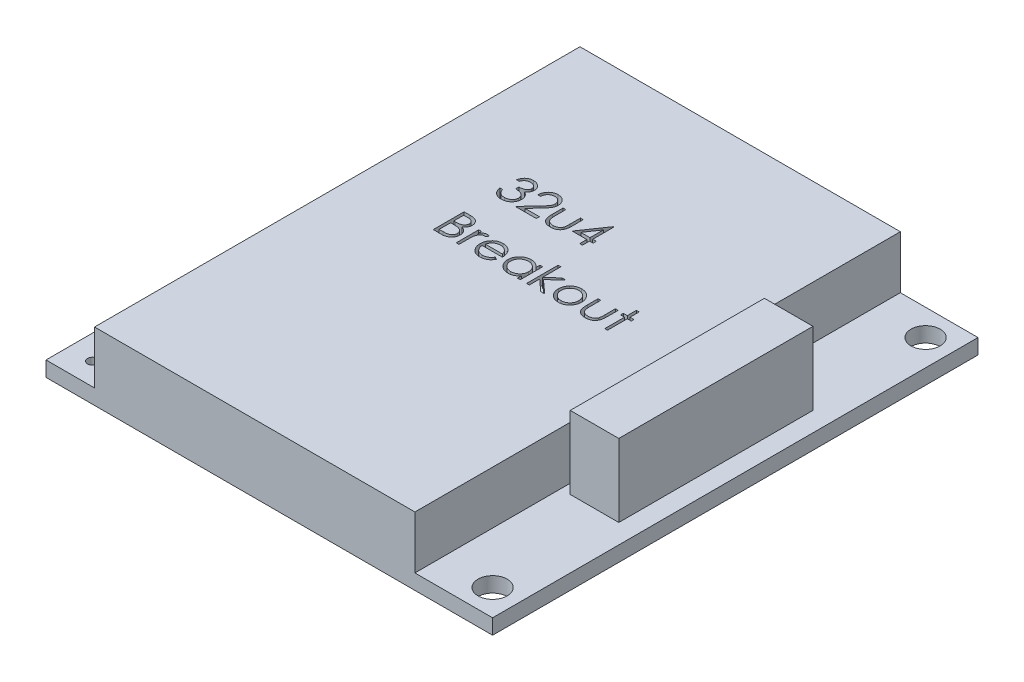
from build123d import *

# Parameters (mm, degrees)
SKETCH1_W             = 46
SKETCH1_H             = 50
BOSS_EXTRUDE1_DEPTH   = 7
F_3_0MM_DOWEL_HOLE1_D = 3
F_1_0MM_DOWEL_HOLE1_D = 1
LPATTERN1_COUNT       = 19
LPATTERN1_PITCH       = 2.54
SKETCH7_W             = 5
SKETCH7_H             = 50
SKETCH7_W_2           = 8
CUT_EXTRUDE1_DEPTH    = 5.44
CUT_EXTRUDE2_DEPTH    = 1
SKETCH9_W             = 5
SKETCH9_H             = 20
BOSS_EXTRUDE2_DEPTH   = 7.5


with BuildPart() as part:
    # Sketch1 → Boss-Extrude1 (new body)
    with BuildSketch(Plane(origin=(0, 0, 0), x_dir=(1, 0, 0), z_dir=(0, 1, 0))):
        Rectangle(SKETCH1_W, SKETCH1_H)
    extrude(amount=BOSS_EXTRUDE1_DEPTH)

    # Ø3.0mm Dowel Hole1 (through all)
    with Locations(Plane(origin=(0, 7, 0), x_dir=(1, 0, 0), z_dir=(0, 1, 0))):
        with Locations((20.3, 22.3), (20.3, -22.3)):
            Hole(F_3_0MM_DOWEL_HOLE1_D / 2)

    # Ø1.0mm Dowel Hole1 (through all)
    with Locations(Plane(origin=(0, 7, 0), x_dir=(1, 0, 0), z_dir=(0, 1, 0))):
        with Locations((-20.5, 23)):
            f_1_0mm_dowel_hole1 = Hole(F_1_0MM_DOWEL_HOLE1_D / 2)

    # LPattern1: Ø1.0mm Dowel Hole1 ×19
    with Locations(*[(0, 0, i * LPATTERN1_PITCH) for i in range(1, LPATTERN1_COUNT)]):
        add(f_1_0mm_dowel_hole1, mode=Mode.SUBTRACT)

    # Sketch7 → Cut-Extrude1 (cut)
    with BuildSketch(Plane(origin=(0, 7, 0), x_dir=(1, 0, 0), z_dir=(0, 1, 0))):
        with Locations((-20.5, 0)):
            Rectangle(SKETCH7_W, SKETCH7_H)
        with Locations((19, 0)):
            Rectangle(SKETCH7_W_2, SKETCH7_H)
    extrude(amount=-CUT_EXTRUDE1_DEPTH, mode=Mode.SUBTRACT)

    # Sketch8 → Cut-Extrude2 (cut)
    # profile 1 of 12: a face of its own
    with BuildSketch(Plane(origin=(0, 7, 0), x_dir=(1, 0, 0), z_dir=(0, 1, 0))):
        with BuildLine():
            Line((-9.122123343, 9.866687663), (-9.40705924, 9.866687663))
            add(Edge.make_bspline(
                [(-9.40705924, 9.866687663), (-9.399339862, 9.898648559), (-9.384249109, 9.961129497), (-9.352773454, 10.050398941), (-9.318484129, 10.134875278), (-9.277309727, 10.212976716), (-9.232398214, 10.286272864), (-9.180942603, 10.353101284), (-9.125316854, 10.415161617), (-9.063789936, 10.470237196), (-8.999266079, 10.520109851), (-8.930836102, 10.562632224), (-8.859876763, 10.599211991), (-8.785896421, 10.629347488), (-8.708674822, 10.652049213), (-8.628910093, 10.668520029), (-8.546393203, 10.679216254), (-8.490379318, 10.680260161), (-8.461937045, 10.680790227)],
                knots=[0, 0, 0, 0, 1.162005537, 2.271625781, 3.343758855, 4.383309926, 5.390229558, 6.379919256, 7.361854164, 8.333198761, 9.295911338, 10.242430842, 11.177959212, 12.116337295, 13.062827104, 14.020064771, 14.994644689, 16, 16, 16, 16], degree=3))
            add(Edge.make_bspline(
                [(-8.461937045, 10.680790227), (-8.420496272, 10.679539068), (-8.338518669, 10.677064042), (-8.218083619, 10.654463089), (-8.101945005, 10.618698861), (-7.991374044, 10.569283409), (-7.888668752, 10.508334918), (-7.79728664, 10.435795478), (-7.718466348, 10.353064683), (-7.652340734, 10.261685857), (-7.600565556, 10.16402693), (-7.562387203, 10.063515359), (-7.539144678, 9.960389571), (-7.536132459, 9.890759753), (-7.534623343, 9.855875363)],
                knots=[0, 0, 0, 0, 1.083050992, 2.142477498, 3.193116406, 4.255571735, 5.30263384, 6.308962982, 7.297363603, 8.282367274, 9.249857812, 10.179914175, 11.08814088, 12, 12, 12, 12], degree=3))
            add(Edge.make_bspline(
                [(-7.534623343, 9.855875363), (-7.535678886, 9.822304914), (-7.537744421, 9.756612754), (-7.555282854, 9.660708253), (-7.584797892, 9.570319087), (-7.625682605, 9.485064747), (-7.678606726, 9.405485785), (-7.742716958, 9.331403155), (-7.818465801, 9.262488276), (-7.875868838, 9.223009897), (-7.90542162, 9.202685259)],
                knots=[0, 0, 0, 0, 1.024540389, 2.004866551, 2.965041327, 3.920577974, 4.882998113, 5.874504559, 6.905732034, 8, 8, 8, 8], degree=3))
            add(Edge.make_bspline(
                [(-7.90542162, 9.202685259), (-7.8716471, 9.186376489), (-7.804730007, 9.154064099), (-7.713516312, 9.090694948), (-7.63071424, 9.017528118), (-7.584537295, 8.96043014), (-7.561336083, 8.931741749)],
                knots=[0, 0, 0, 0, 1.015518401, 2.012035669, 3.001164323, 4, 4, 4, 4], degree=3))
            add(Edge.make_bspline(
                [(-7.561336083, 8.931741749), (-7.54605858, 8.910825075), (-7.515753753, 8.86933425), (-7.478347233, 8.802626207), (-7.444411822, 8.735178784), (-7.417968409, 8.66518418), (-7.397490687, 8.593453661), (-7.382853, 8.519864059), (-7.373759673, 8.444355281), (-7.372457422, 8.393271817), (-7.37180283, 8.367594113)],
                knots=[0, 0, 0, 0, 1.025084078, 2.033381695, 3.024893161, 4.013698104, 4.991890475, 5.976764909, 6.982997093, 8, 8, 8, 8], degree=3))
            add(Edge.make_bspline(
                [(-7.37180283, 8.367594113), (-7.37343071, 8.323135295), (-7.37667881, 8.234426882), (-7.405711077, 8.10336767), (-7.450717374, 7.975255964), (-7.51463188, 7.852723789), (-7.592525978, 7.738078729), (-7.685197264, 7.635502363), (-7.791592792, 7.547329343), (-7.910252202, 7.473660065), (-8.038809883, 7.414770235), (-8.176310599, 7.373896698), (-8.320773148, 7.347275684), (-8.419839767, 7.344421024), (-8.470205274, 7.342969714)],
                knots=[0, 0, 0, 0, 0.955779014, 1.907060117, 2.875433937, 3.871313158, 4.872415639, 5.851225146, 6.836215519, 7.83643374, 8.849228613, 9.86973379, 10.916971861, 12, 12, 12, 12], degree=3))
            add(Edge.make_bspline(
                [(-8.470205274, 7.342969714), (-8.504149925, 7.343757308), (-8.570941679, 7.345307029), (-8.669133995, 7.355901189), (-8.762861537, 7.37525055), (-8.852251029, 7.401288549), (-8.937381884, 7.434301058), (-9.017994322, 7.475411591), (-9.094584297, 7.523772739), (-9.16642906, 7.579955351), (-9.233520046, 7.642803424), (-9.294074303, 7.713432668), (-9.349101401, 7.790537456), (-9.397127937, 7.875013371), (-9.440341459, 7.965768712), (-9.475884184, 8.063965564), (-9.507167521, 8.16872607), (-9.521712164, 8.241730877), (-9.529174625, 8.279187663)],
                knots=[0, 0, 0, 0, 1.048658725, 2.063410685, 3.046034179, 4.001477787, 4.936774919, 5.862367409, 6.792675028, 7.730719943, 8.675894397, 9.627829632, 10.600096036, 11.597688215, 12.626045268, 13.701542398, 14.82072376, 16, 16, 16, 16], degree=3))
            Line((-9.529174625, 8.279187663), (-9.244238728, 8.279187663))
            add(Edge.make_bspline(
                [(-9.244238728, 8.279187663), (-9.236815313, 8.254741058), (-9.222376127, 8.207190288), (-9.197797729, 8.138755154), (-9.169795796, 8.07601892), (-9.139756161, 8.018521373), (-9.108207142, 7.965696265), (-9.072905745, 7.918940427), (-9.036466592, 7.876200208), (-9.008998893, 7.852120453), (-8.995555835, 7.840335499)],
                knots=[0, 0, 0, 0, 1.198163088, 2.33053128, 3.407730985, 4.417276592, 5.372219308, 6.28897303, 7.162600585, 8, 8, 8, 8], degree=3))
            add(Edge.make_bspline(
                [(-8.995555835, 7.840335499), (-8.977778941, 7.826630082), (-8.942280025, 7.799261553), (-8.88443313, 7.764335076), (-8.823595697, 7.73407186), (-8.758449528, 7.710954508), (-8.690400415, 7.691380487), (-8.618348448, 7.678571159), (-8.542929301, 7.669782603), (-8.49143283, 7.669007058), (-8.465117133, 7.66861074)],
                knots=[0, 0, 0, 0, 0.946170439, 1.889420265, 2.845303464, 3.807233317, 4.801018734, 5.828864929, 6.890507805, 8, 8, 8, 8], degree=3))
            add(Edge.make_bspline(
                [(-8.465117133, 7.66861074), (-8.435405027, 7.669169454), (-8.377305569, 7.670261971), (-8.292528661, 7.680309219), (-8.211876905, 7.694941809), (-8.136245751, 7.717541443), (-8.064644505, 7.745464073), (-7.998076865, 7.780523697), (-7.935668969, 7.821657838), (-7.878220151, 7.868411217), (-7.826562441, 7.919593574), (-7.78107874, 7.97312686), (-7.742412082, 8.028785362), (-7.711221265, 8.086877086), (-7.686591837, 8.147161472), (-7.669824934, 8.209807696), (-7.658166774, 8.274303073), (-7.657217347, 8.318144352), (-7.656738728, 8.340245355)],
                knots=[0, 0, 0, 0, 1.217147791, 2.380027433, 3.494444702, 4.572153297, 5.609568379, 6.639424714, 7.649109417, 8.668170816, 9.669597737, 10.625200337, 11.543417969, 12.441394052, 13.322311151, 14.205496177, 15.095365482, 16, 16, 16, 16], degree=3))
            add(Edge.make_bspline(
                [(-7.656738728, 8.340245355), (-7.65812693, 8.369828498), (-7.660896426, 8.428847583), (-7.682040638, 8.515677097), (-7.716819465, 8.599336907), (-7.7655081, 8.678399659), (-7.824776939, 8.751674941), (-7.894050819, 8.817054072), (-7.973904998, 8.87100194), (-8.047401593, 8.908275221), (-8.112502842, 8.933708854), (-8.16821537, 8.950649714), (-8.230587431, 8.964994959), (-8.298864762, 8.978341091), (-8.373561823, 8.989699743), (-8.454597291, 8.999171961), (-8.541987589, 9.006751177), (-8.602486004, 9.010135813), (-8.633661805, 9.011879971)],
                knots=[0, 0, 0, 0, 1.07054697, 2.135767047, 3.216561865, 4.33974944, 5.486079747, 6.621378074, 7.775625952, 8.963672916, 9.598146892, 10.304877434, 11.070270905, 11.915000392, 12.823868403, 13.805723172, 14.86925407, 16, 16, 16, 16], degree=3))
            Line((-8.633661805, 9.011879971), (-8.633661805, 9.337520996))
            add(Edge.make_bspline(
                [(-8.633661805, 9.337520996), (-8.594381461, 9.338187568), (-8.517440918, 9.339493219), (-8.405051085, 9.355284771), (-8.297578866, 9.377129341), (-8.197406036, 9.41058948), (-8.106103274, 9.449451749), (-8.026891921, 9.494674825), (-7.960881723, 9.544943919), (-7.908393465, 9.601034928), (-7.868906237, 9.66119215), (-7.840034785, 9.723890832), (-7.822980203, 9.789680516), (-7.820703577, 9.834579251), (-7.81955924, 9.857147398)],
                knots=[0, 0, 0, 0, 1.321986639, 2.589447074, 3.816329219, 5.01088745, 6.139805852, 7.153945165, 8.075214402, 8.924034688, 9.728124013, 10.488707548, 11.240355623, 12, 12, 12, 12], degree=3))
            add(Edge.make_bspline(
                [(-7.81955924, 9.857147398), (-7.81993517, 9.873727924), (-7.820683065, 9.906714094), (-7.830114881, 9.954906121), (-7.844288119, 10.001624836), (-7.863773302, 10.046671564), (-7.889853839, 10.089733884), (-7.921064984, 10.131178927), (-7.958228904, 10.170770069), (-8.00081513, 10.207672931), (-8.046545839, 10.242842167), (-8.096665278, 10.272699538), (-8.149662264, 10.29823113), (-8.205595473, 10.319285464), (-8.264646418, 10.335123533), (-8.326537652, 10.346495332), (-8.391387194, 10.353605204), (-8.435630122, 10.354628838), (-8.458120939, 10.355149201)],
                knots=[0, 0, 0, 0, 0.884392785, 1.759457502, 2.611959086, 3.489218968, 4.37281399, 5.2945488, 6.255912374, 7.266815255, 8.301784654, 9.332968512, 10.37626691, 11.440494194, 12.520033166, 13.637162961, 14.798855837, 16, 16, 16, 16], degree=3))
            add(Edge.make_bspline(
                [(-8.458120939, 10.355149201), (-8.494272095, 10.353887037), (-8.564883711, 10.351421737), (-8.666678671, 10.329829004), (-8.76131121, 10.295377456), (-8.833645572, 10.254253932), (-8.887060478, 10.213658895), (-8.925230272, 10.178205588), (-8.962713878, 10.138805812), (-8.997045314, 10.093032857), (-9.031765278, 10.043986555), (-9.063374273, 9.989173643), (-9.094089851, 9.930023943), (-9.112597878, 9.888208617), (-9.122123343, 9.866687663)],
                knots=[0, 0, 0, 0, 1.472543308, 2.876219568, 4.221790263, 5.565193594, 6.249813518, 6.953379497, 7.687249741, 8.463570142, 9.283606569, 10.136032583, 11.040678096, 12, 12, 12, 12], degree=3))
        make_face()
    # profile 2 of 12: a face of its own
    with BuildSketch(Plane(origin=(0, 7, 0), x_dir=(1, 0, 0), z_dir=(0, 1, 0))):
        with BuildLine():
            Line((-6.679815651, 9.622456894), (-6.964751548, 9.622456894))
            add(Edge.make_bspline(
                [(-6.964751548, 9.622456894), (-6.962894488, 9.660258342), (-6.959247271, 9.73449938), (-6.942167323, 9.842743209), (-6.917728099, 9.946207205), (-6.883173708, 10.044060627), (-6.840260156, 10.137168688), (-6.788797917, 10.22516156), (-6.727843496, 10.307703566), (-6.658713101, 10.384029517), (-6.583630121, 10.454049671), (-6.502616876, 10.514515498), (-6.41748603, 10.565603671), (-6.328495861, 10.608313084), (-6.23464235, 10.640371372), (-6.136777186, 10.664158145), (-6.034470398, 10.678469545), (-5.964765521, 10.680007865), (-5.929314849, 10.680790227)],
                knots=[0, 0, 0, 0, 1.10065271, 2.161652631, 3.183658789, 4.190468796, 5.17591951, 6.163126047, 7.15150782, 8.156236427, 9.156009102, 10.134482811, 11.092018607, 12.041330605, 13.001268258, 13.972401359, 14.968799086, 16, 16, 16, 16], degree=3))
            add(Edge.make_bspline(
                [(-5.929314849, 10.680790227), (-5.894500454, 10.679975199), (-5.82609141, 10.678373697), (-5.726249439, 10.664620478), (-5.631201465, 10.643079834), (-5.541133277, 10.612857992), (-5.45676349, 10.572232118), (-5.377458299, 10.523430065), (-5.302273564, 10.46698779), (-5.234594553, 10.400536116), (-5.172447938, 10.329595382), (-5.11883375, 10.253859926), (-5.07292038, 10.175637646), (-5.034650127, 10.094332063), (-5.006477773, 10.00917763), (-4.98508897, 9.921414096), (-4.972999102, 9.830133017), (-4.97114361, 9.768350642), (-4.970200266, 9.736940067)],
                knots=[0, 0, 0, 0, 1.111607364, 2.184268762, 3.212621178, 4.221274766, 5.211760367, 6.196651075, 7.1921475, 8.207485113, 9.220403448, 10.201281604, 11.166441695, 12.114753415, 13.065576456, 14.026450734, 14.996634279, 16, 16, 16, 16], degree=3))
            add(Edge.make_bspline(
                [(-4.970200266, 9.736940067), (-4.971736297, 9.692718817), (-4.974781405, 9.605052337), (-5.000829446, 9.476224569), (-5.041511639, 9.351407682), (-5.090494955, 9.250953129), (-5.139909244, 9.170005602), (-5.184438626, 9.103358992), (-5.236567418, 9.031599031), (-5.297054342, 8.954966018), (-5.364648161, 8.872859697), (-5.439961124, 8.785329668), (-5.523530283, 8.693280277), (-5.58218478, 8.630410196), (-5.612578071, 8.597832495)],
                knots=[0, 0, 0, 0, 1.184426356, 2.348067706, 3.509069118, 4.696110526, 5.333549288, 6.050745305, 6.844228056, 7.710549037, 8.667450064, 9.695053472, 10.805634456, 12, 12, 12, 12], degree=3))
            Line((-5.612578071, 8.597832495), (-6.406964088, 7.750020996))
            Line((-6.406964088, 7.750020996), (-4.929495138, 7.750020996))
            Line((-4.929495138, 7.750020996), (-4.929495138, 7.424379971))
            Line((-4.929495138, 7.424379971), (-7.086866933, 7.424379971))
            Line((-7.086866933, 7.424379971), (-5.855536805, 8.73839239))
            add(Edge.make_bspline(
                [(-5.855536805, 8.73839239), (-5.82555765, 8.769687283), (-5.76797383, 8.829798366), (-5.686528207, 8.917558052), (-5.613377124, 8.998973706), (-5.548047061, 9.073891504), (-5.491955238, 9.143407283), (-5.442178285, 9.205269622), (-5.402295213, 9.262196873), (-5.359010533, 9.328183001), (-5.31708785, 9.40874846), (-5.281063069, 9.507204021), (-5.259096743, 9.608556601), (-5.256461642, 9.677047734), (-5.255136164, 9.711499362)],
                knots=[0, 0, 0, 0, 1.329631726, 2.553950428, 3.673215718, 4.687767853, 5.603093632, 6.413772471, 7.123043292, 7.734684054, 8.834405432, 9.900288307, 10.943827018, 12, 12, 12, 12], degree=3))
            add(Edge.make_bspline(
                [(-5.255136164, 9.711499362), (-5.255712873, 9.733163202), (-5.256849455, 9.77585847), (-5.266880367, 9.838456551), (-5.282039183, 9.898840347), (-5.303760953, 9.957195594), (-5.332432781, 10.012935579), (-5.367333633, 10.06612815), (-5.407601762, 10.11755314), (-5.454184699, 10.165770774), (-5.505358006, 10.209931582), (-5.559418504, 10.249051288), (-5.616613956, 10.28174391), (-5.67670321, 10.308544083), (-5.739518743, 10.329567464), (-5.805182047, 10.34413489), (-5.873511691, 10.353281143), (-5.920169219, 10.354518642), (-5.943943255, 10.355149201)],
                knots=[0, 0, 0, 0, 0.991446411, 1.95395049, 2.89581595, 3.838931463, 4.798493298, 5.75982156, 6.748411868, 7.785213223, 8.824556874, 9.840280684, 10.836137867, 11.835679398, 12.848801643, 13.863922112, 14.911575587, 16, 16, 16, 16], degree=3))
            add(Edge.make_bspline(
                [(-5.943943255, 10.355149201), (-5.96877251, 10.354500565), (-6.017533068, 10.35322675), (-6.089123905, 10.344316191), (-6.157418861, 10.328943893), (-6.22258973, 10.307919338), (-6.284746783, 10.281196226), (-6.343587737, 10.247911572), (-6.398980501, 10.208193689), (-6.451029204, 10.163162612), (-6.498984385, 10.113027003), (-6.541118337, 10.057137965), (-6.577933835, 9.996515952), (-6.610055068, 9.931324539), (-6.636140587, 9.860972181), (-6.656073374, 9.78570862), (-6.671845728, 9.705860653), (-6.677114886, 9.650719897), (-6.679815651, 9.622456894)],
                knots=[0, 0, 0, 0, 1.031018746, 2.02475058, 2.990194455, 3.934040569, 4.864654155, 5.795059489, 6.735614925, 7.690564532, 8.649604399, 9.611025574, 10.590972636, 11.591080095, 12.624614302, 13.701020113, 14.821632451, 16, 16, 16, 16], degree=3))
        make_face()
    # profile 3 of 12: a face of its own
    with BuildSketch(Plane(origin=(0, 7, 0), x_dir=(1, 0, 0), z_dir=(0, 1, 0))):
        with BuildLine():
            Line((-4.481738728, 9.744572278), (-4.19680283, 9.744572278))
            Line((-4.19680283, 9.744572278), (-4.19680283, 8.668430451))
            add(Edge.make_bspline(
                [(-4.19680283, 8.668430451), (-4.196674102, 8.636841243), (-4.196427851, 8.576412568), (-4.194757855, 8.48945822), (-4.190829842, 8.410158773), (-4.185918729, 8.338468419), (-4.179603077, 8.274399285), (-4.172088886, 8.218175154), (-4.163690175, 8.16915843), (-4.155468999, 8.139636957), (-4.151645579, 8.125907414)],
                knots=[0, 0, 0, 0, 1.388932606, 2.656963016, 3.823490214, 4.879454478, 5.816252168, 6.653371382, 7.373723809, 8, 8, 8, 8], degree=3))
            add(Edge.make_bspline(
                [(-4.151645579, 8.125907414), (-4.145511973, 8.108650953), (-4.133372278, 8.074496787), (-4.11135276, 8.02515819), (-4.084112769, 7.979460612), (-4.054304211, 7.935641918), (-4.019924034, 7.895000115), (-3.981407228, 7.857603837), (-3.940043113, 7.822040126), (-3.878579628, 7.779962493), (-3.794524437, 7.734863587), (-3.684168009, 7.695950951), (-3.564512032, 7.6726956), (-3.481812608, 7.669997526), (-3.439305835, 7.66861074)],
                knots=[0, 0, 0, 0, 0.725840625, 1.436591201, 2.137033971, 2.831655856, 3.53531722, 4.242432219, 4.957935707, 5.694543706, 7.190802206, 8.724350549, 10.316345118, 12, 12, 12, 12], degree=3))
            add(Edge.make_bspline(
                [(-3.439305835, 7.66861074), (-3.39680301, 7.670027015), (-3.314567908, 7.672767246), (-3.196226615, 7.695249456), (-3.088048546, 7.732810331), (-2.991119469, 7.785249912), (-2.905879028, 7.849423069), (-2.834845734, 7.924723917), (-2.776237724, 8.008770147), (-2.75064775, 8.071475742), (-2.737778391, 8.10301078)],
                knots=[0, 0, 0, 0, 1.157059328, 2.238695713, 3.266970494, 4.264342957, 5.228770407, 6.160125903, 7.074715775, 8, 8, 8, 8], degree=3))
            add(Edge.make_bspline(
                [(-2.737778391, 8.10301078), (-2.733973625, 8.115680208), (-2.725562217, 8.143689219), (-2.716524941, 8.191205134), (-2.708383822, 8.247869454), (-2.701432227, 8.314052971), (-2.696474544, 8.389582731), (-2.693802077, 8.474435129), (-2.690782856, 8.568343791), (-2.69073703, 8.634082402), (-2.690713087, 8.668430451)],
                knots=[0, 0, 0, 0, 0.557542046, 1.232589297, 2.036731608, 2.971723315, 4.038036528, 5.22795436, 6.551621927, 8, 8, 8, 8], degree=3))
            Line((-2.690713087, 8.668430451), (-2.690713087, 9.744572278))
            Line((-2.690713087, 9.744572278), (-2.405777189, 9.744572278))
            Line((-2.405777189, 9.744572278), (-2.405777189, 8.615004971))
            add(Edge.make_bspline(
                [(-2.405777189, 8.615004971), (-2.406177869, 8.576626322), (-2.406955244, 8.502166494), (-2.411951191, 8.393958765), (-2.42052334, 8.293118728), (-2.433534204, 8.199593007), (-2.44883378, 8.113453006), (-2.468569828, 8.034588323), (-2.492135801, 7.963241942), (-2.518720089, 7.898161901), (-2.550127069, 7.839155076), (-2.583534438, 7.783151871), (-2.622110481, 7.731541851), (-2.662723479, 7.681755912), (-2.707900696, 7.636270384), (-2.756795568, 7.594041545), (-2.808719898, 7.554423866), (-2.864825957, 7.518962491), (-2.924294671, 7.487015963), (-2.987199455, 7.458698521), (-3.05431079, 7.436289755), (-3.124762803, 7.416957936), (-3.198900667, 7.401795525), (-3.276652909, 7.391103425), (-3.35799334, 7.384549018), (-3.41342835, 7.383971127), (-3.441849906, 7.383674842)],
                knots=[0, 0, 0, 0, 1.493040784, 2.896703357, 4.213163133, 5.428574705, 6.569057535, 7.615249723, 8.588095153, 9.490268104, 10.346124644, 11.18633936, 12.024365274, 12.850166724, 13.684164916, 14.514361689, 15.362232829, 16.222528818, 17.093394965, 17.986930858, 18.902426812, 19.842810585, 20.827885679, 21.843828298, 22.894529745, 24, 24, 24, 24], degree=3))
            add(Edge.make_bspline(
                [(-3.441849906, 7.383674842), (-3.470058886, 7.383983005), (-3.525492159, 7.384588574), (-3.606836788, 7.391067214), (-3.684804452, 7.401778912), (-3.759117957, 7.417069002), (-3.829851874, 7.436154444), (-3.89729272, 7.458836222), (-3.96065081, 7.487030659), (-4.020687342, 7.518760301), (-4.076932365, 7.554651658), (-4.129645147, 7.593992665), (-4.178755006, 7.636724594), (-4.224272775, 7.682668982), (-4.265559546, 7.732395774), (-4.303129813, 7.785504961), (-4.337561967, 7.841470313), (-4.368724855, 7.901399039), (-4.395496233, 7.967232219), (-4.419132064, 8.040073157), (-4.438463857, 8.12072044), (-4.454195953, 8.209105118), (-4.466851903, 8.304804192), (-4.475638618, 8.408371254), (-4.48055155, 8.519554032), (-4.48133447, 8.596343575), (-4.481738728, 8.635993552)],
                knots=[0, 0, 0, 0, 1.083640291, 2.129454052, 3.13281866, 4.105697902, 5.042300162, 5.946461698, 6.836384745, 7.703652036, 8.553297018, 9.397182691, 10.228592656, 11.052265423, 11.879314572, 12.708807002, 13.549817954, 14.402308542, 15.300838682, 16.27712199, 17.341985831, 18.484375296, 19.725102775, 21.0496083, 22.476576903, 24, 24, 24, 24], degree=3))
            Line((-4.481738728, 8.635993552), (-4.481738728, 9.744572278))
        make_face()
    # profile 4 of 12: a face of its own
    with BuildSketch(Plane(origin=(0, 7, 0), x_dir=(1, 0, 0), z_dir=(0, 1, 0))):
        Polygon((-0.224872742, 10.680790227), (-0.166995138, 10.680790227), (-0.166995138, 8.482713304), (0.199351016, 8.482713304), (0.199351016, 8.157072278), (-0.166995138, 8.157072278), (-0.166995138, 7.424379971), (-0.451931035, 7.424379971), (-0.451931035, 8.157072278), (-1.958020779, 8.157072278), align=None)
        Polygon((-0.451931035, 8.482713304), (-0.451931035, 9.861599522), (-1.398325266, 8.482713304), align=None, mode=Mode.SUBTRACT)
    # profile 5 of 12: a face of its own
    with BuildSketch(Plane(origin=(0, 7, 0), x_dir=(1, 0, 0), z_dir=(0, 1, 0))):
        with BuildLine():
            Line((-9.244238728, 4.307713304), (-8.624757558, 4.307713304))
            add(Edge.make_bspline(
                [(-8.624757558, 4.307713304), (-8.594433153, 4.307553873), (-8.535656908, 4.307244857), (-8.450186414, 4.302452302), (-8.370132136, 4.295917544), (-8.295470857, 4.285548817), (-8.226237077, 4.273037705), (-8.162222149, 4.257886772), (-8.103629636, 4.239719773), (-8.033677368, 4.210830646), (-7.953920768, 4.167901772), (-7.867562226, 4.104466574), (-7.793716952, 4.026876411), (-7.730047935, 3.939352859), (-7.679428348, 3.843072552), (-7.642807629, 3.740330288), (-7.619622985, 3.632451279), (-7.617238619, 3.558389253), (-7.616033599, 3.520959498)],
                knots=[0, 0, 0, 0, 1.001505555, 1.941167018, 2.826882275, 3.653841531, 4.429895133, 5.150066043, 5.825578002, 6.45369114, 7.647487171, 8.808567382, 9.977351308, 11.170798116, 12.373658725, 13.556498008, 14.765093433, 16, 16, 16, 16], degree=3))
            add(Edge.make_bspline(
                [(-7.616033599, 3.520959498), (-7.617025305, 3.485896108), (-7.618974099, 3.41699324), (-7.637609317, 3.316215013), (-7.666783637, 3.22028355), (-7.707337685, 3.129548957), (-7.760044495, 3.046061323), (-7.822508827, 2.96914716), (-7.897871355, 2.902062987), (-7.954334866, 2.864559068), (-7.983015771, 2.845508777)],
                knots=[0, 0, 0, 0, 1.044552857, 2.05264487, 3.044412934, 4.028983338, 5.005914585, 5.980388656, 6.974128949, 8, 8, 8, 8], degree=3))
            add(Edge.make_bspline(
                [(-7.983015771, 2.845508777), (-7.946947383, 2.831661242), (-7.877939622, 2.805167478), (-7.782974454, 2.758326735), (-7.701154844, 2.707379678), (-7.631851719, 2.651742928), (-7.572581132, 2.591772793), (-7.520825964, 2.526589939), (-7.476665003, 2.455344066), (-7.438825422, 2.378778002), (-7.409299051, 2.297673562), (-7.387186623, 2.212791501), (-7.374516151, 2.124436191), (-7.372713077, 2.064305882), (-7.37180283, 2.033950283)],
                knots=[0, 0, 0, 0, 1.27268992, 2.434971085, 3.483601985, 4.442670788, 5.356604649, 6.2567628, 7.179492994, 8.113709626, 9.066344395, 10.018646069, 10.999752585, 12, 12, 12, 12], degree=3))
            add(Edge.make_bspline(
                [(-7.37180283, 2.033950283), (-7.372688969, 2.002956049), (-7.374432472, 1.941974025), (-7.387295732, 1.85238901), (-7.409075422, 1.766777452), (-7.439075676, 1.684585607), (-7.478230062, 1.605972485), (-7.525880429, 1.530849024), (-7.582696205, 1.459970025), (-7.646253236, 1.392547881), (-7.718155325, 1.331925531), (-7.795730332, 1.277936283), (-7.879955207, 1.233535212), (-7.969446659, 1.196237107), (-8.065208574, 1.167746291), (-8.16681094, 1.147814028), (-8.274166128, 1.134383744), (-8.347834973, 1.133279565), (-8.38561493, 1.132713304)],
                knots=[0, 0, 0, 0, 0.978564426, 1.925352924, 2.850884081, 3.763762016, 4.682927383, 5.618979971, 6.567305752, 7.547517671, 8.540179244, 9.531824382, 10.526200242, 11.540722885, 12.589160233, 13.674978461, 14.80764778, 16, 16, 16, 16], degree=3))
            Line((-8.38561493, 1.132713304), (-9.244238728, 1.132713304))
            Line((-9.244238728, 1.132713304), (-9.244238728, 4.307713304))
        make_face()
        with BuildLine():
            Line((-8.95930283, 3.982072278), (-8.95930283, 2.964444073))
            Line((-8.95930283, 2.964444073), (-8.767861524, 2.964444073))
            add(Edge.make_bspline(
                [(-8.767861524, 2.964444073), (-8.73987726, 2.96480686), (-8.685805958, 2.965507839), (-8.607501481, 2.967515816), (-8.534816643, 2.973138326), (-8.467876908, 2.978759221), (-8.406787691, 2.987898311), (-8.351684331, 2.99877688), (-8.301702033, 3.010282087), (-8.244062588, 3.029848693), (-8.178682127, 3.058766298), (-8.108983526, 3.103644321), (-8.047538685, 3.157097127), (-7.995652665, 3.218774642), (-7.953187974, 3.286688968), (-7.92369339, 3.359756495), (-7.903693353, 3.436156187), (-7.90188675, 3.488605602), (-7.900969497, 3.515235339)],
                knots=[0, 0, 0, 0, 1.156816544, 2.235205308, 3.236616184, 4.169592532, 5.011045266, 5.787822928, 6.49130361, 7.128639758, 8.301311294, 9.436451833, 10.541879658, 11.654887649, 12.756523258, 13.837046038, 14.901820046, 16, 16, 16, 16], degree=3))
            add(Edge.make_bspline(
                [(-7.900969497, 3.515235339), (-7.901446817, 3.532857289), (-7.902383134, 3.567424668), (-7.910051487, 3.617815868), (-7.92308493, 3.665208415), (-7.93982561, 3.710251786), (-7.963219635, 3.751537536), (-7.990763633, 3.790493149), (-8.024042795, 3.825792), (-8.061922643, 3.85878433), (-8.105473323, 3.888034723), (-8.154668852, 3.91365313), (-8.210174816, 3.934282263), (-8.271055763, 3.952349059), (-8.338248821, 3.965038439), (-8.410978594, 3.975609727), (-8.489840804, 3.980991571), (-8.544401004, 3.981704008), (-8.572604112, 3.982072278)],
                knots=[0, 0, 0, 0, 0.91205012, 1.789085906, 2.630437955, 3.453916878, 4.269457761, 5.079663411, 5.91843418, 6.774407191, 7.675494373, 8.627863946, 9.638891023, 10.736472738, 11.911756761, 13.175263542, 14.539845004, 16, 16, 16, 16], degree=3))
            Line((-8.572604112, 3.982072278), (-8.95930283, 3.982072278))
        make_face(mode=Mode.SUBTRACT)
        with BuildLine():
            Line((-8.95930283, 2.638803047), (-8.95930283, 1.45835433))
            Line((-8.95930283, 1.45835433), (-8.553523583, 1.45835433))
            add(Edge.make_bspline(
                [(-8.553523583, 1.45835433), (-8.524477843, 1.458702443), (-8.468496009, 1.459373386), (-8.387668464, 1.461563732), (-8.312753792, 1.466546011), (-8.24409384, 1.474389032), (-8.180947215, 1.482896625), (-8.124071442, 1.494336858), (-8.073005473, 1.50744413), (-8.013792351, 1.527704415), (-7.947114169, 1.55917907), (-7.875258606, 1.606635547), (-7.811371965, 1.663171691), (-7.757120052, 1.728604734), (-7.712658269, 1.799753152), (-7.680313678, 1.875177863), (-7.660364829, 1.953632591), (-7.657949861, 2.007123823), (-7.656738728, 2.033950283)],
                knots=[0, 0, 0, 0, 1.160039823, 2.235823828, 3.228722157, 4.157150951, 4.99529583, 5.772374946, 6.472645482, 7.099169577, 8.269452708, 9.405989375, 10.527446681, 11.663510218, 12.788923519, 13.866172445, 14.929861265, 16, 16, 16, 16], degree=3))
            add(Edge.make_bspline(
                [(-7.656738728, 2.033950283), (-7.656989194, 2.050726385), (-7.657486086, 2.084007988), (-7.664979644, 2.132917339), (-7.67587794, 2.180293666), (-7.689967169, 2.226265617), (-7.710486257, 2.270002037), (-7.734440766, 2.31236793), (-7.76252718, 2.353419301), (-7.806291531, 2.405318988), (-7.869947545, 2.465115135), (-7.960395834, 2.523659869), (-8.063240705, 2.570874666), (-8.137832787, 2.590922048), (-8.17636513, 2.601278007)],
                knots=[0, 0, 0, 0, 0.723448775, 1.435228256, 2.130040452, 2.821711965, 3.505591119, 4.210454504, 4.921174351, 5.648778258, 7.137944449, 8.670945889, 10.280296675, 12, 12, 12, 12], degree=3))
            add(Edge.make_bspline(
                [(-8.17636513, 2.601278007), (-8.191812953, 2.604412262), (-8.225307018, 2.611207973), (-8.279923895, 2.61838139), (-8.342277147, 2.624772265), (-8.412510758, 2.62949953), (-8.490713585, 2.634385894), (-8.577052647, 2.636286196), (-8.671175354, 2.638553382), (-8.73648272, 2.638717697), (-8.770405595, 2.638803047)],
                knots=[0, 0, 0, 0, 0.634451884, 1.375622551, 2.216452059, 3.157844607, 4.20941857, 5.370758133, 6.634282058, 8, 8, 8, 8], degree=3))
            Line((-8.770405595, 2.638803047), (-8.95930283, 2.638803047))
        make_face(mode=Mode.SUBTRACT)
    # profile 6 of 12: a face of its own
    with BuildSketch(Plane(origin=(0, 7, 0), x_dir=(1, 0, 0), z_dir=(0, 1, 0))):
        with BuildLine():
            Line((-6.883341292, 3.452905612), (-6.598405394, 3.452905612))
            Line((-6.598405394, 3.452905612), (-6.598405394, 3.111364145))
            add(Edge.make_bspline(
                [(-6.598405394, 3.111364145), (-6.577369877, 3.143164789), (-6.537139615, 3.203983275), (-6.470271458, 3.284418998), (-6.40177915, 3.351016933), (-6.331334801, 3.404087982), (-6.258420382, 3.44383274), (-6.184636147, 3.472945707), (-6.108821257, 3.490160843), (-6.057874368, 3.492459234), (-6.032349705, 3.49361074)],
                knots=[0, 0, 0, 0, 1.2804753, 2.448899062, 3.506932113, 4.484331642, 5.4025378, 6.288909075, 7.142734305, 8, 8, 8, 8], degree=3))
            add(Edge.make_bspline(
                [(-6.032349705, 3.49361074), (-6.012550109, 3.492530762), (-5.971811153, 3.490308638), (-5.910141232, 3.474695961), (-5.846601815, 3.449769469), (-5.805651221, 3.426328696), (-5.78430283, 3.414108536)],
                knots=[0, 0, 0, 0, 0.901110191, 1.854092781, 2.881294221, 4, 4, 4, 4], degree=3))
            Line((-5.78430283, 3.414108536), (-5.940763167, 3.167333696))
            add(Edge.make_bspline(
                [(-5.940763167, 3.167333696), (-5.954469207, 3.173448081), (-5.980485896, 3.185054353), (-6.018544681, 3.198790319), (-6.05363418, 3.206878328), (-6.075989408, 3.208103622), (-6.086411204, 3.208674842)],
                knots=[0, 0, 0, 0, 1.180555205, 2.24091978, 3.179933427, 4, 4, 4, 4], degree=3))
            add(Edge.make_bspline(
                [(-6.086411204, 3.208674842), (-6.109276405, 3.207150808), (-6.155914787, 3.204042221), (-6.224390011, 3.179604874), (-6.290835691, 3.140121263), (-6.343605699, 3.096332469), (-6.384465457, 3.054106967), (-6.413621233, 3.017233059), (-6.440366296, 2.975886729), (-6.46592071, 2.930774801), (-6.489203706, 2.881127013), (-6.510934013, 2.827439383), (-6.530581696, 2.769649731), (-6.541785131, 2.729388445), (-6.547523984, 2.708764987)],
                knots=[0, 0, 0, 0, 1.125678352, 2.296057538, 3.5422874, 4.923748041, 5.663163013, 6.437101912, 7.23742474, 8.08941207, 8.991984279, 9.93940061, 10.944477711, 12, 12, 12, 12], degree=3))
            add(Edge.make_bspline(
                [(-6.547523984, 2.708764987), (-6.551816941, 2.690370693), (-6.561325514, 2.649628732), (-6.570570695, 2.581276856), (-6.579705186, 2.50051968), (-6.586142833, 2.407132413), (-6.592110057, 2.301348268), (-6.595475631, 2.183006088), (-6.598290623, 2.051984406), (-6.598365977, 1.960386242), (-6.598405394, 1.912470916)],
                knots=[0, 0, 0, 0, 0.566838948, 1.255505196, 2.06880316, 3.007127437, 4.065329342, 5.249902469, 6.561414163, 8, 8, 8, 8], degree=3))
            Line((-6.598405394, 1.912470916), (-6.598405394, 1.132713304))
            Line((-6.598405394, 1.132713304), (-6.883341292, 1.132713304))
            Line((-6.883341292, 1.132713304), (-6.883341292, 3.452905612))
        make_face()
    # profile 7 of 12: a face of its own
    with BuildSketch(Plane(origin=(0, 7, 0), x_dir=(1, 0, 0), z_dir=(0, 1, 0))):
        with BuildLine():
            Line((-3.595130154, 1.865405612), (-3.341995138, 1.732477927))
            add(Edge.make_bspline(
                [(-3.341995138, 1.732477927), (-3.362166906, 1.696697191), (-3.40141318, 1.627082048), (-3.468905287, 1.531440289), (-3.539655238, 1.445399861), (-3.616856695, 1.371259389), (-3.698199904, 1.306624204), (-3.784135955, 1.250074891), (-3.87511224, 1.201888805), (-3.971133061, 1.161291869), (-4.073004797, 1.130077542), (-4.180974316, 1.108030142), (-4.295248458, 1.094401891), (-4.373576778, 1.092818799), (-4.413684841, 1.092008176)],
                knots=[0, 0, 0, 0, 1.120438281, 2.179929193, 3.190490725, 4.156257408, 5.095198341, 6.022838206, 6.959905092, 7.901321166, 8.864066838, 9.862729781, 10.905609505, 12, 12, 12, 12], degree=3))
            add(Edge.make_bspline(
                [(-4.413684841, 1.092008176), (-4.458263635, 1.093048828), (-4.545223948, 1.095078838), (-4.671806433, 1.112579859), (-4.790986334, 1.141129785), (-4.90275695, 1.181012812), (-5.006844565, 1.233107598), (-5.103456055, 1.296570843), (-5.193099482, 1.371076531), (-5.272950014, 1.457270019), (-5.344835537, 1.54951008), (-5.408268245, 1.645627204), (-5.461297486, 1.745379558), (-5.504434496, 1.848132104), (-5.539273195, 1.953237208), (-5.563554419, 2.061651182), (-5.577551405, 2.173080605), (-5.579696295, 2.248461759), (-5.580777189, 2.286449281)],
                knots=[0, 0, 0, 0, 1.145258523, 2.234067595, 3.276747158, 4.290159414, 5.277019952, 6.260822364, 7.254936242, 8.264827045, 9.274100331, 10.257902744, 11.220704747, 12.172965371, 13.118907548, 14.062713208, 15.023725156, 16, 16, 16, 16], degree=3))
            add(Edge.make_bspline(
                [(-5.580777189, 2.286449281), (-5.579816397, 2.322095306), (-5.577912233, 2.39274102), (-5.565910019, 2.497303335), (-5.544639067, 2.598929146), (-5.515450545, 2.697702895), (-5.477757628, 2.793459202), (-5.431645544, 2.886256346), (-5.377042458, 2.97599558), (-5.334885104, 3.032604137), (-5.313649785, 3.061118753)],
                knots=[0, 0, 0, 0, 1.024358464, 2.0301432, 3.019427413, 4.004406732, 4.986367066, 5.972626655, 6.978780325, 8, 8, 8, 8], degree=3))
            add(Edge.make_bspline(
                [(-5.313649785, 3.061118753), (-5.284886387, 3.095471228), (-5.228270743, 3.163087978), (-5.132516049, 3.251932031), (-5.028829442, 3.326357456), (-4.918510325, 3.388049643), (-4.800276523, 3.434925023), (-4.67571738, 3.469856901), (-4.543414599, 3.48943124), (-4.45296772, 3.49219606), (-4.406688647, 3.49361074)],
                knots=[0, 0, 0, 0, 1.030682036, 2.02871468, 2.997146059, 3.962720338, 4.930598197, 5.918074684, 6.934738563, 8, 8, 8, 8], degree=3))
            add(Edge.make_bspline(
                [(-4.406688647, 3.49361074), (-4.359111177, 3.492382424), (-4.265775025, 3.489972748), (-4.129674458, 3.467633146), (-4.000895808, 3.4322069), (-3.879490608, 3.382174533), (-3.765446549, 3.317622654), (-3.659504918, 3.237665412), (-3.559853903, 3.144757576), (-3.501879692, 3.073308093), (-3.472378752, 3.036950083)],
                knots=[0, 0, 0, 0, 1.056321875, 2.072262726, 3.055038591, 4.01806755, 4.982017516, 5.957941055, 6.960871419, 8, 8, 8, 8], degree=3))
            add(Edge.make_bspline(
                [(-3.472378752, 3.036950083), (-3.452306458, 3.00955112), (-3.412295477, 2.954935569), (-3.362178465, 2.865880305), (-3.318674256, 2.772707123), (-3.283900784, 2.673909925), (-3.255743523, 2.570659306), (-3.23537198, 2.46221714), (-3.223425255, 2.348615721), (-3.221076936, 2.271212345), (-3.219879753, 2.231751765)],
                knots=[0, 0, 0, 0, 0.94817472, 1.890038105, 2.849395472, 3.817997239, 4.812318967, 5.836947057, 6.897266129, 8, 8, 8, 8], degree=3))
            Line((-3.219879753, 2.231751765), (-5.295841292, 2.231751765))
            add(Edge.make_bspline(
                [(-5.295841292, 2.231751765), (-5.294444649, 2.20118063), (-5.291698207, 2.141063725), (-5.278893755, 2.053097372), (-5.258710939, 1.969301554), (-5.230345432, 1.890304795), (-5.195994794, 1.815075322), (-5.153916322, 1.744171189), (-5.103715441, 1.677915352), (-5.047721414, 1.615715163), (-4.985394263, 1.56032433), (-4.919823485, 1.510747361), (-4.850070037, 1.469195141), (-4.776683919, 1.43546767), (-4.699783799, 1.409064083), (-4.619345451, 1.391041131), (-4.53552716, 1.378969685), (-4.478390101, 1.377627417), (-4.449301829, 1.376944073)],
                knots=[0, 0, 0, 0, 1.094153842, 2.151609401, 3.174256925, 4.172055639, 5.149267565, 6.128595816, 7.11444997, 8.118368179, 9.117203808, 10.09244225, 11.054858984, 12.015122123, 12.976791628, 13.957293641, 14.960065497, 16, 16, 16, 16], degree=3))
            add(Edge.make_bspline(
                [(-4.449301829, 1.376944073), (-4.420861859, 1.377495667), (-4.364431504, 1.378590136), (-4.280393012, 1.389232655), (-4.19771644, 1.406441405), (-4.116743977, 1.429927325), (-4.039118995, 1.458572041), (-3.967231961, 1.493136776), (-3.901119194, 1.531372618), (-3.839327374, 1.57510568), (-3.779391544, 1.628634535), (-3.719935146, 1.695432654), (-3.656184182, 1.774433482), (-3.616279337, 1.833892765), (-3.595130154, 1.865405612)],
                knots=[0, 0, 0, 0, 0.99110716, 1.966546729, 2.947904876, 3.932708344, 4.903319531, 5.828989031, 6.710028674, 7.56322171, 8.463672341, 9.504779593, 10.677557249, 12, 12, 12, 12], degree=3))
        make_face()
        with BuildLine():
            add(Edge.make_bspline(
                [(-3.504815651, 2.516687663), (-3.515244732, 2.554481841), (-3.535317355, 2.627223468), (-3.577260343, 2.727953419), (-3.624496669, 2.817477443), (-3.680396382, 2.895110396), (-3.743731941, 2.96405644), (-3.816888642, 3.024307585), (-3.898926917, 3.078207702), (-3.989422709, 3.123703183), (-4.0852549, 3.162428984), (-4.185590517, 3.188396053), (-4.287968653, 3.206184709), (-4.357214755, 3.20784125), (-4.392060242, 3.208674842)],
                knots=[0, 0, 0, 0, 1.154881502, 2.222775134, 3.210006277, 4.132804581, 5.035138423, 5.962687519, 6.919655026, 7.923214229, 8.944639381, 9.960483929, 10.97369054, 12, 12, 12, 12], degree=3))
            add(Edge.make_bspline(
                [(-4.392060242, 3.208674842), (-4.420498661, 3.208119969), (-4.476715437, 3.207023101), (-4.559538549, 3.196618055), (-4.639076562, 3.179418767), (-4.715916358, 3.155864842), (-4.789051003, 3.124469895), (-4.859984829, 3.087655111), (-4.926914188, 3.042713817), (-4.968770935, 3.008461142), (-4.989916813, 2.991156813)],
                knots=[0, 0, 0, 0, 1.04873581, 2.073130211, 3.073294108, 4.04793562, 5.032784715, 6.005352987, 6.992311501, 8, 8, 8, 8], degree=3))
            add(Edge.make_bspline(
                [(-4.989916813, 2.991156813), (-5.005060004, 2.977464113), (-5.035706133, 2.949753424), (-5.076655035, 2.902011215), (-5.115862178, 2.850529441), (-5.15154342, 2.793338507), (-5.184270945, 2.731089657), (-5.214896067, 2.664307945), (-5.242460884, 2.592486605), (-5.257969498, 2.542437321), (-5.265948463, 2.516687663)],
                knots=[0, 0, 0, 0, 0.879870761, 1.780643979, 2.707998968, 3.669668524, 4.684282772, 5.740141944, 6.837334558, 8, 8, 8, 8], degree=3))
            Line((-5.265948463, 2.516687663), (-3.504815651, 2.516687663))
        make_face(mode=Mode.SUBTRACT)
    # profile 8 of 12: a face of its own
    with BuildSketch(Plane(origin=(0, 7, 0), x_dir=(1, 0, 0), z_dir=(0, 1, 0))):
        with BuildLine():
            Line((-0.289110522, 3.452905612), (-0.289110522, 1.132713304))
            Line((-0.289110522, 1.132713304), (-0.57404642, 1.132713304))
            Line((-0.57404642, 1.132713304), (-0.57404642, 1.534040427))
            add(Edge.make_bspline(
                [(-0.57404642, 1.534040427), (-0.606176323, 1.497718796), (-0.668878232, 1.426836675), (-0.773599818, 1.334233561), (-0.884605237, 1.257690369), (-1.001355721, 1.19586866), (-1.123745841, 1.149430152), (-1.251504292, 1.116422708), (-1.384683188, 1.095201157), (-1.475626395, 1.093082052), (-1.521712686, 1.092008176)],
                knots=[0, 0, 0, 0, 1.074387032, 2.096679803, 3.090159297, 4.057316773, 5.018401886, 5.985159533, 6.978961417, 8, 8, 8, 8], degree=3))
            add(Edge.make_bspline(
                [(-1.521712686, 1.092008176), (-1.562686473, 1.093120671), (-1.643488594, 1.09531456), (-1.762350686, 1.112334649), (-1.876734369, 1.139667428), (-1.986747731, 1.17767752), (-2.091678892, 1.228097265), (-2.192426265, 1.288459683), (-2.288467922, 1.360342436), (-2.378339961, 1.442518719), (-2.461100418, 1.531777029), (-2.53372743, 1.626977632), (-2.594282009, 1.727708865), (-2.644918797, 1.832695369), (-2.683922623, 1.942745332), (-2.711112992, 2.057478191), (-2.728113254, 2.176758291), (-2.730306236, 2.25798343), (-2.731418215, 2.299169634)],
                knots=[0, 0, 0, 0, 1.033919861, 2.038935746, 3.024066025, 3.998881131, 4.97069526, 5.957263378, 6.95902576, 7.993208707, 9.027059324, 10.027763471, 11.009749337, 11.988697705, 12.965288445, 13.950418724, 14.960734635, 16, 16, 16, 16], degree=3))
            add(Edge.make_bspline(
                [(-2.731418215, 2.299169634), (-2.730281591, 2.339504565), (-2.728034546, 2.419244548), (-2.71129484, 2.536518795), (-2.683145282, 2.649474646), (-2.643641163, 2.757748445), (-2.592984532, 2.861471204), (-2.531364053, 2.960716284), (-2.458775276, 3.055757095), (-2.375089164, 3.144358851), (-2.284434051, 3.226201836), (-2.187452559, 3.297330042), (-2.086557154, 3.358758898), (-1.980182852, 3.407430265), (-1.869904121, 3.446808525), (-1.75473921, 3.474052717), (-1.635167277, 3.490106716), (-1.553986617, 3.492431509), (-1.512808439, 3.49361074)],
                knots=[0, 0, 0, 0, 1.020392517, 2.01726096, 2.990465484, 3.961182959, 4.928053699, 5.906110375, 6.912531644, 7.948652711, 8.985773172, 9.998621852, 10.987621588, 11.969261332, 12.953316658, 13.946091881, 14.958173133, 16, 16, 16, 16], degree=3))
            add(Edge.make_bspline(
                [(-1.512808439, 3.49361074), (-1.46545571, 3.492306494), (-1.372599243, 3.489748929), (-1.236774548, 3.468464883), (-1.108282772, 3.432507131), (-0.986132038, 3.383596258), (-0.870760988, 3.318600625), (-0.763261852, 3.236613089), (-0.662509592, 3.138150726), (-0.60410747, 3.062521823), (-0.57404642, 3.023593713)],
                knots=[0, 0, 0, 0, 1.038897134, 2.037228247, 3.008116434, 3.962042015, 4.918381754, 5.904844433, 6.921570401, 8, 8, 8, 8], degree=3))
            Line((-0.57404642, 3.023593713), (-0.57404642, 3.452905612))
            Line((-0.57404642, 3.452905612), (-0.289110522, 3.452905612))
        make_face()
        with BuildLine():
            add(Edge.make_bspline(
                [(-1.508992333, 3.208674842), (-1.550643197, 3.2071929), (-1.632855377, 3.20426778), (-1.753545293, 3.181431824), (-1.869036747, 3.143436513), (-1.978752115, 3.091473646), (-2.080958283, 3.026133292), (-2.172301827, 2.947101751), (-2.253529849, 2.856535317), (-2.321845203, 2.754842688), (-2.377535154, 2.645823991), (-2.416693818, 2.53186468), (-2.442519493, 2.415020164), (-2.445157936, 2.335769728), (-2.446482317, 2.295989546)],
                knots=[0, 0, 0, 0, 1.031046209, 2.035121221, 3.029706178, 4.034933723, 5.034054252, 6.02443088, 7.017295772, 8.038157696, 9.050218397, 10.03989886, 11.016116709, 12, 12, 12, 12], degree=3))
            add(Edge.make_bspline(
                [(-2.446482317, 2.295989546), (-2.444790593, 2.256447091), (-2.441413774, 2.177517176), (-2.417147073, 2.060513367), (-2.376434616, 1.9465272), (-2.320879317, 1.836526156), (-2.251313593, 1.734396294), (-2.170678887, 1.642103468), (-2.078195417, 1.562737913), (-1.975754036, 1.496300971), (-1.866345377, 1.442632113), (-1.751288882, 1.405288997), (-1.63274741, 1.381179153), (-1.55214565, 1.378362949), (-1.511536404, 1.376944073)],
                knots=[0, 0, 0, 0, 0.979072187, 1.954306742, 2.945804271, 3.96968567, 4.997920485, 5.998718438, 6.996577872, 8.005894225, 9.015743152, 10.005417472, 10.995077863, 12, 12, 12, 12], degree=3))
            add(Edge.make_bspline(
                [(-1.511536404, 1.376944073), (-1.470309934, 1.378449898), (-1.388314573, 1.381444833), (-1.267266602, 1.404378552), (-1.149796172, 1.442268819), (-1.037503472, 1.494791598), (-0.932895267, 1.559885771), (-0.839007907, 1.636092204), (-0.759618421, 1.72472295), (-0.692315125, 1.822128732), (-0.639541711, 1.928910329), (-0.601100572, 2.042606345), (-0.5783731, 2.163220738), (-0.575508588, 2.2456473), (-0.57404642, 2.287721317)],
                knots=[0, 0, 0, 0, 1.01762866, 2.023962475, 3.030623092, 4.058876274, 5.077231937, 6.066672613, 7.034107872, 8.005628644, 8.981990164, 9.965428785, 10.961468474, 12, 12, 12, 12], degree=3))
            add(Edge.make_bspline(
                [(-0.57404642, 2.287721317), (-0.574916965, 2.319777777), (-0.576630474, 2.382875036), (-0.589721062, 2.475519284), (-0.61054446, 2.564177736), (-0.639887057, 2.648943604), (-0.678432722, 2.729348225), (-0.724921767, 2.805968921), (-0.780171711, 2.878407192), (-0.843293156, 2.945665549), (-0.912385876, 3.007012411), (-0.985496638, 3.061771401), (-1.063491644, 3.106755502), (-1.145059242, 3.143985798), (-1.230340952, 3.173612313), (-1.320030729, 3.193376864), (-1.413175238, 3.206948012), (-1.476717017, 3.208093172), (-1.508992333, 3.208674842)],
                knots=[0, 0, 0, 0, 1.050140795, 2.067009409, 3.05949893, 4.030605086, 5.00011959, 5.97591094, 6.962425594, 7.979863591, 8.993523472, 9.986985069, 10.967611495, 11.937549037, 12.921786183, 13.919465291, 14.943216303, 16, 16, 16, 16], degree=3))
        make_face(mode=Mode.SUBTRACT)
    # profile 9 of 12: a face of its own
    with BuildSketch(Plane(origin=(0, 7, 0), x_dir=(1, 0, 0), z_dir=(0, 1, 0))):
        Polygon((0.362171529, 4.38912356), (0.647107426, 4.38912356), (0.647107426, 2.506511381), (1.702896689, 3.452905612), (2.112492042, 3.452905612), (0.88752209, 2.35386715), (2.234607426, 1.132713304), (1.825648091, 1.132713304), (0.647107426, 2.201858937), (0.647107426, 1.132713304), (0.362171529, 1.132713304), align=None)
    # profile 10 of 12: a face of its own
    with BuildSketch(Plane(origin=(0, 7, 0), x_dir=(1, 0, 0), z_dir=(0, 1, 0))):
        with BuildLine():
            add(Edge.make_bspline(
                [(3.680911513, 3.49361074), (3.724446453, 3.492683739), (3.809807832, 3.490866116), (3.934819271, 3.471439682), (4.054149502, 3.441733145), (4.168255547, 3.400665371), (4.275676044, 3.345618173), (4.377975672, 3.279932601), (4.474873959, 3.202115534), (4.532951993, 3.141919287), (4.562431945, 3.111364145)],
                knots=[0, 0, 0, 0, 1.054011418, 2.066658804, 3.057071809, 4.030435133, 4.997543892, 5.974964718, 6.972108034, 8, 8, 8, 8], degree=3))
            add(Edge.make_bspline(
                [(4.562431945, 3.111364145), (4.587815575, 3.082141458), (4.638091592, 3.024261623), (4.702558351, 2.930412603), (4.758095052, 2.833221226), (4.802602166, 2.731396865), (4.837695009, 2.625828414), (4.862610319, 2.516153018), (4.877430253, 2.402612889), (4.879428659, 2.325502264), (4.88044076, 2.286449281)],
                knots=[0, 0, 0, 0, 1.025258237, 2.030674902, 3.01204498, 3.988269485, 4.97094183, 5.956517959, 6.965070386, 8, 8, 8, 8], degree=3))
            add(Edge.make_bspline(
                [(4.88044076, 2.286449281), (4.879550546, 2.247169943), (4.877791444, 2.16955214), (4.861151163, 2.055234572), (4.835269392, 1.944386411), (4.798229082, 1.837471739), (4.750732797, 1.734163746), (4.692774816, 1.634913655), (4.623948421, 1.539525648), (4.545930509, 1.448809695), (4.459704879, 1.365201771), (4.366163802, 1.292332555), (4.2671455, 1.229901601), (4.161333315, 1.179612853), (4.049693523, 1.13996191), (3.931985326, 1.11211261), (3.808391583, 1.095274511), (3.724002604, 1.093112269), (3.680911513, 1.092008176)],
                knots=[0, 0, 0, 0, 0.998656419, 1.973391657, 2.932242238, 3.890759089, 4.846373663, 5.82037756, 6.809684879, 7.83454468, 8.860553229, 9.859544525, 10.845671541, 11.83227036, 12.833544569, 13.85385346, 14.904124723, 16, 16, 16, 16], degree=3))
            add(Edge.make_bspline(
                [(3.680911513, 1.092008176), (3.637609303, 1.093115975), (3.552799737, 1.095285656), (3.428769739, 1.112047191), (3.310850585, 1.139949075), (3.199064642, 1.179743158), (3.092797531, 1.229903209), (2.993205494, 1.292143813), (2.899588428, 1.365223382), (2.813344557, 1.448803839), (2.735331536, 1.539527157), (2.666503879, 1.634913263), (2.608546226, 1.734163848), (2.561049855, 1.837471712), (2.524009567, 1.944386419), (2.498127791, 2.05523457), (2.481487512, 2.16955214), (2.479728409, 2.247169944), (2.478838195, 2.286449281)],
                knots=[0, 0, 0, 0, 1.099876186, 2.154163076, 3.173186993, 4.173200201, 5.163417411, 6.152872554, 7.150605724, 8.17532212, 9.198891216, 10.186952605, 11.159729845, 12.11414092, 13.071450619, 14.029093627, 15.002601286, 16, 16, 16, 16], degree=3))
            add(Edge.make_bspline(
                [(2.478838195, 2.286449281), (2.479857198, 2.325290005), (2.481874649, 2.402187963), (2.496679682, 2.515514654), (2.521497801, 2.625004428), (2.556632711, 2.730165396), (2.601550063, 2.831543541), (2.656306374, 2.928975067), (2.721430734, 3.022399714), (2.77150679, 3.080204744), (2.79684701, 3.109456092)],
                knots=[0, 0, 0, 0, 1.031353054, 2.041901799, 3.029428768, 4.008703097, 4.981709435, 5.96992636, 6.972712378, 8, 8, 8, 8], degree=3))
            add(Edge.make_bspline(
                [(2.79684701, 3.109456092), (2.826282517, 3.140276216), (2.884172622, 3.200889412), (2.981553254, 3.27847963), (3.08360122, 3.345532068), (3.192208832, 3.399485492), (3.306221138, 3.441974719), (3.42616288, 3.471516294), (3.551598526, 3.490796123), (3.637377611, 3.492663184), (3.680911513, 3.49361074)],
                knots=[0, 0, 0, 0, 1.027980169, 2.021703884, 2.998553061, 3.971491411, 4.943284454, 5.930300938, 6.949603206, 8, 8, 8, 8], degree=3))
        make_face()
        with BuildLine():
            add(Edge.make_bspline(
                [(3.679639478, 3.208674842), (3.648853216, 3.20779982), (3.588075435, 3.206072364), (3.498613383, 3.192933393), (3.4124891, 3.172116728), (3.329539192, 3.142540192), (3.250043385, 3.104350476), (3.17392557, 3.057443607), (3.100961857, 3.002440853), (3.032579557, 2.939428287), (2.969821316, 2.870595199), (2.914959152, 2.797254188), (2.868309234, 2.720594859), (2.82944709, 2.640537496), (2.800502712, 2.556270807), (2.77948147, 2.468749091), (2.766354895, 2.377794035), (2.76464368, 2.315962254), (2.763774093, 2.284541229)],
                knots=[0, 0, 0, 0, 1.021534396, 2.016698045, 2.994645724, 3.958388632, 4.93408049, 5.916473867, 6.921342795, 7.962252576, 8.998418191, 10.008913653, 10.997312074, 11.973003931, 12.956656626, 13.948281152, 14.957379055, 16, 16, 16, 16], degree=3))
            add(Edge.make_bspline(
                [(2.763774093, 2.284541229), (2.765231711, 2.243944747), (2.768124812, 2.163368322), (2.791651776, 2.044703946), (2.83100933, 1.930783266), (2.884156362, 1.822274116), (2.950746289, 1.721878549), (3.029202414, 1.632369417), (3.118682714, 1.555093717), (3.218120539, 1.490976093), (3.325484813, 1.440031171), (3.43911019, 1.403927815), (3.557619963, 1.380458494), (3.63861034, 1.378125799), (3.679639478, 1.376944073)],
                knots=[0, 0, 0, 0, 1.016792936, 2.018143844, 3.017858371, 4.030088057, 5.03801393, 6.028138512, 7.003788237, 7.991172063, 8.984598303, 9.972568034, 10.972917682, 12, 12, 12, 12], degree=3))
            add(Edge.make_bspline(
                [(3.679639478, 1.376944073), (3.720666255, 1.378132684), (3.801651974, 1.38047897), (3.919997085, 1.403809614), (4.033311902, 1.440189363), (4.140564661, 1.490918797), (4.239957222, 1.555337201), (4.330081068, 1.631933058), (4.407867308, 1.722115623), (4.474391364, 1.822407095), (4.528408766, 1.930615043), (4.567582099, 2.044724972), (4.591165624, 2.163362967), (4.59405109, 2.243942953), (4.595504862, 2.284541229)],
                knots=[0, 0, 0, 0, 1.02726834, 2.027799167, 3.010890988, 4.004497153, 4.992059811, 5.971914811, 6.958719428, 7.966827853, 8.981595046, 9.981490638, 10.983022906, 12, 12, 12, 12], degree=3))
            add(Edge.make_bspline(
                [(4.595504862, 2.284541229), (4.594635574, 2.315962442), (4.592924949, 2.377794592), (4.579794088, 2.468746961), (4.558788706, 2.556278623), (4.529785881, 2.640508655), (4.491092597, 2.720802141), (4.443543078, 2.797029108), (4.388904934, 2.87084926), (4.325389402, 2.939205777), (4.257078481, 3.002465417), (4.184085196, 3.057464935), (4.108080252, 3.104144325), (4.028815394, 3.142866843), (3.945854851, 3.171847645), (3.859851241, 3.193053589), (3.770770892, 3.206016839), (3.710210903, 3.207783175), (3.679639478, 3.208674842)],
                knots=[0, 0, 0, 0, 1.042956736, 2.052379634, 3.044323526, 4.02829302, 5.004299113, 5.996692471, 7.007513377, 8.048758398, 9.090003419, 10.095195979, 11.07790575, 12.047570684, 13.018257071, 13.989683339, 14.985167495, 16, 16, 16, 16], degree=3))
        make_face(mode=Mode.SUBTRACT)
    # profile 11 of 12: a face of its own
    with BuildSketch(Plane(origin=(0, 7, 0), x_dir=(1, 0, 0), z_dir=(0, 1, 0))):
        with BuildLine():
            Line((5.409607426, 3.452905612), (5.694543324, 3.452905612))
            Line((5.694543324, 3.452905612), (5.694543324, 2.376763785))
            add(Edge.make_bspline(
                [(5.694543324, 2.376763785), (5.694672052, 2.345174576), (5.694918302, 2.284745901), (5.696588299, 2.197791553), (5.700516312, 2.118492106), (5.705427425, 2.046801752), (5.711743077, 1.982732619), (5.719257268, 1.926508488), (5.727655979, 1.877491763), (5.735877155, 1.847970291), (5.739700575, 1.834240748)],
                knots=[0, 0, 0, 0, 1.388932606, 2.656963016, 3.823490214, 4.879454478, 5.816252168, 6.653371382, 7.373723809, 8, 8, 8, 8], degree=3))
            add(Edge.make_bspline(
                [(5.739700575, 1.834240748), (5.745834181, 1.816984286), (5.757973876, 1.782830121), (5.779993393, 1.733491523), (5.807233384, 1.687793946), (5.837041943, 1.643975251), (5.871422119, 1.603333449), (5.909938925, 1.565937171), (5.95130304, 1.530373459), (6.012766526, 1.488295826), (6.096821717, 1.44319692), (6.207178145, 1.404284285), (6.326834122, 1.381028934), (6.409533545, 1.378330859), (6.452040319, 1.376944073)],
                knots=[0, 0, 0, 0, 0.725840625, 1.436591201, 2.137033971, 2.831655856, 3.53531722, 4.242432219, 4.957935707, 5.694543706, 7.190802206, 8.724350549, 10.316345118, 12, 12, 12, 12], degree=3))
            add(Edge.make_bspline(
                [(6.452040319, 1.376944073), (6.494543144, 1.378360349), (6.576778246, 1.38110058), (6.695119539, 1.40358279), (6.803297608, 1.441143665), (6.900226685, 1.493583245), (6.985467126, 1.557756402), (7.05650042, 1.63305725), (7.11510843, 1.71710348), (7.140698404, 1.779809076), (7.153567763, 1.811344113)],
                knots=[0, 0, 0, 0, 1.157059328, 2.238695713, 3.266970494, 4.264342957, 5.228770407, 6.160125903, 7.074715775, 8, 8, 8, 8], degree=3))
            add(Edge.make_bspline(
                [(7.153567763, 1.811344113), (7.157372529, 1.824013541), (7.165783937, 1.852022552), (7.174821213, 1.899538467), (7.182962331, 1.956202787), (7.189913927, 2.022386305), (7.19487161, 2.097916065), (7.197544077, 2.182768462), (7.200563298, 2.276677125), (7.200609124, 2.342415735), (7.200633067, 2.376763785)],
                knots=[0, 0, 0, 0, 0.557542046, 1.232589297, 2.036731608, 2.971723315, 4.038036528, 5.22795436, 6.551621927, 8, 8, 8, 8], degree=3))
            Line((7.200633067, 2.376763785), (7.200633067, 3.452905612))
            Line((7.200633067, 3.452905612), (7.485568965, 3.452905612))
            Line((7.485568965, 3.452905612), (7.485568965, 2.323338304))
            add(Edge.make_bspline(
                [(7.485568965, 2.323338304), (7.485168284, 2.284959655), (7.48439091, 2.210499828), (7.479394962, 2.102292098), (7.470822814, 2.001452062), (7.45781195, 1.907926341), (7.442512373, 1.821786339), (7.422776326, 1.742921656), (7.399210353, 1.671575275), (7.372626064, 1.606495235), (7.341219085, 1.547488409), (7.307811716, 1.491485204), (7.269235673, 1.439875184), (7.228622675, 1.390089246), (7.183445458, 1.344603717), (7.134550586, 1.302374878), (7.082626255, 1.2627572), (7.026520197, 1.227295825), (6.967051483, 1.195349296), (6.904146698, 1.167031854), (6.837035364, 1.144623088), (6.766583351, 1.12529127), (6.692445487, 1.110128858), (6.614693245, 1.099436759), (6.533352814, 1.092882351), (6.477917804, 1.09230446), (6.449496248, 1.092008176)],
                knots=[0, 0, 0, 0, 1.493040784, 2.896703357, 4.213163133, 5.428574705, 6.569057535, 7.615249723, 8.588095153, 9.490268104, 10.346124644, 11.18633936, 12.024365274, 12.850166724, 13.684164916, 14.514361689, 15.362232829, 16.222528818, 17.093394965, 17.986930858, 18.902426812, 19.842810585, 20.827885679, 21.843828298, 22.894529745, 24, 24, 24, 24], degree=3))
            add(Edge.make_bspline(
                [(6.449496248, 1.092008176), (6.421287268, 1.092316339), (6.365853995, 1.092921907), (6.284509366, 1.099400547), (6.206541702, 1.110112245), (6.132228197, 1.125402335), (6.06149428, 1.144487777), (5.994053434, 1.167169556), (5.930695344, 1.195363993), (5.870658812, 1.227093634), (5.814413788, 1.262984991), (5.761701007, 1.302325998), (5.712591148, 1.345057927), (5.667073379, 1.391002315), (5.625786607, 1.440729108), (5.588216341, 1.493838294), (5.553784187, 1.549803646), (5.522621299, 1.609732372), (5.49584992, 1.675565552), (5.47221409, 1.74840649), (5.452882297, 1.829053774), (5.4371502, 1.917438452), (5.424494251, 2.013137525), (5.415707536, 2.116704587), (5.410794604, 2.227887365), (5.410011684, 2.304676908), (5.409607426, 2.344326886)],
                knots=[0, 0, 0, 0, 1.083640291, 2.129454052, 3.13281866, 4.105697902, 5.042300162, 5.946461698, 6.836384745, 7.703652036, 8.553297018, 9.397182691, 10.228592656, 11.052265423, 11.879314572, 12.708807002, 13.549817954, 14.402308542, 15.300838682, 16.27712199, 17.341985831, 18.484375296, 19.725102775, 21.0496083, 22.476576903, 24, 24, 24, 24], degree=3))
            Line((5.409607426, 2.344326886), (5.409607426, 3.452905612))
        make_face()
    # profile 12 of 12: a face of its own
    with BuildSketch(Plane(origin=(0, 7, 0), x_dir=(1, 0, 0), z_dir=(0, 1, 0))):
        Polygon((8.421786913, 4.38912356), (8.706722811, 4.38912356), (8.706722811, 3.452905612), (9.113774093, 3.452905612), (9.113774093, 3.167969714), (8.706722811, 3.167969714), (8.706722811, 1.132713304), (8.421786913, 1.132713304), (8.421786913, 3.167969714), (8.014735631, 3.167969714), (8.014735631, 3.452905612), (8.421786913, 3.452905612), align=None)
    extrude(amount=-CUT_EXTRUDE2_DEPTH, mode=Mode.SUBTRACT)

    # Sketch9 → Boss-Extrude2 (add)
    with BuildSketch(Plane(origin=(0, 1.56, 0), x_dir=(1, 0, 0), z_dir=(0, 1, 0))):
        with Locations((18.5, 0)):
            Rectangle(SKETCH9_W, SKETCH9_H)
    extrude(amount=BOSS_EXTRUDE2_DEPTH)


solid = part.part
